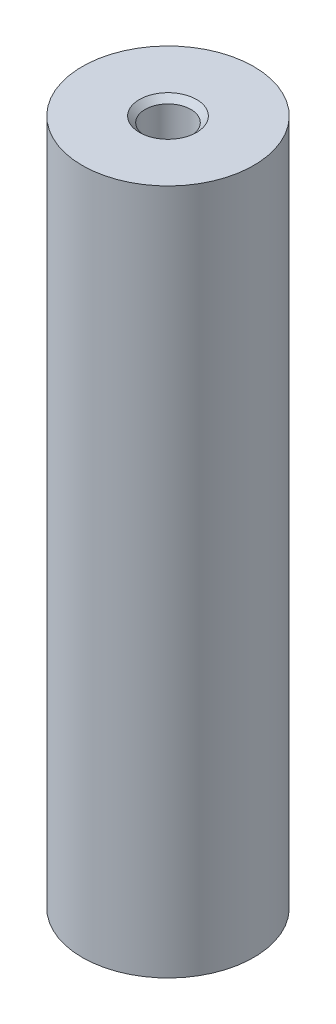
from build123d import *

# Parameters (mm, degrees)
SKETCH1_R           = 7.5
BOSS_EXTRUDE1_DEPTH = 60
SKETCH2_R           = 2
CUT_EXTRUDE1_DEPTH  = 5
CHAMFER1_SIZE       = 0.5
CUT_EXTRUDE2_START  = -5
SKETCH3_R           = 2
CUT_EXTRUDE2_DEPTH  = 5
CHAMFER2_SIZE       = 0.5


with BuildPart() as part:
    # Sketch1 → Boss-Extrude1 (new body)
    with BuildSketch(Plane(origin=(0, 0, 0), x_dir=(1, 0, 0), z_dir=(0, 1, 0))):
        with Locations(Location((0, 0, 0), (0, 0, 270))):
            Circle(SKETCH1_R)
    extrude(amount=BOSS_EXTRUDE1_DEPTH)

    # Sketch2 → Cut-Extrude1 (cut)
    with BuildSketch(Plane(origin=(0, 60, 0), x_dir=(1, 0, 0), z_dir=(0, 1, 0))):
        with Locations(Location((0, 0, 0), (0, 0, 270))):
            Circle(SKETCH2_R)
    extrude(amount=-CUT_EXTRUDE1_DEPTH, mode=Mode.SUBTRACT)

    # Chamfer1
    chamfer1_edges = [part.edges().sort_by_distance(p)[0] for p in [
        (0, 60, -2),
    ]]
    chamfer(chamfer1_edges, length=CHAMFER1_SIZE)

    # Sketch3 → Cut-Extrude2 (cut)
    with BuildSketch(Plane.XZ.offset(CUT_EXTRUDE2_START)):
        with Locations(Location((0, 0, 0), (0, 0, 90))):
            Circle(SKETCH3_R)
    extrude(amount=CUT_EXTRUDE2_DEPTH, mode=Mode.SUBTRACT)

    # Chamfer2
    chamfer2_edges = [part.edges().sort_by_distance(p)[0] for p in [
        (0, 0, -2),
    ]]
    chamfer(chamfer2_edges, length=CHAMFER2_SIZE)


solid = part.part
